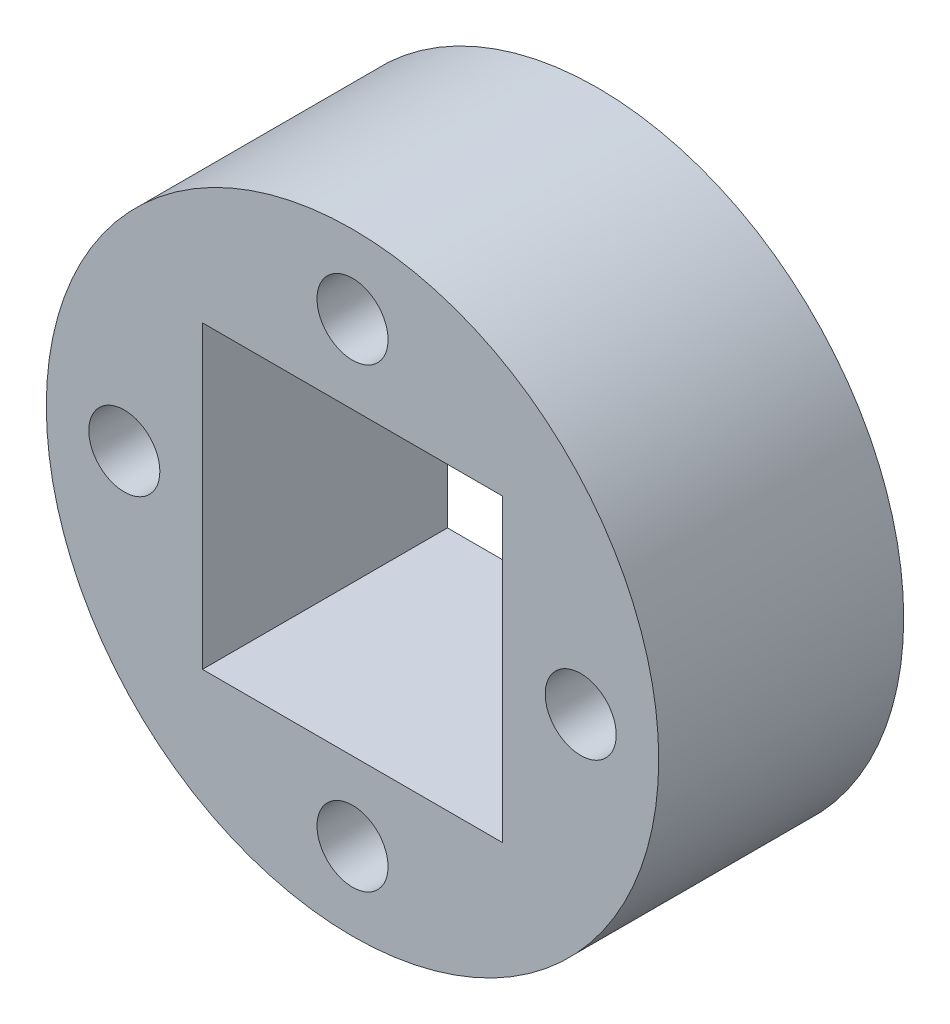
from build123d import *

# Parameters (mm, degrees)
SKETCH1_R           = 12.5
BOSS_EXTRUDE1_DEPTH = 5
CUT_EXTRUDE1_REACH  = 22.31
SKETCH8_W           = 12.25
SKETCH8_H           = 12.25
CUT_EXTRUDE4_REACH  = 22.31
SKETCH11_R          = 1.45


with BuildPart() as part:
    # Sketch1 → Boss-Extrude1 (new, symmetric)
    with BuildSketch(Plane.XY):
        Circle(SKETCH1_R)
    extrude(amount=BOSS_EXTRUDE1_DEPTH, both=True)

    # Sketch8 → Cut-Extrude1 (cut, up to next)
    with BuildSketch(Plane.XY.offset(5), mode=Mode.PRIVATE) as cut_extrude1_sk1:
        Rectangle(SKETCH8_W, SKETCH8_H)
    cut_extrude1_tool1 = extrude(cut_extrude1_sk1.sketch, amount=-CUT_EXTRUDE1_REACH, mode=Mode.PRIVATE) & part.part
    add(cut_extrude1_tool1.solids().sort_by_distance((0, 0, 5))[0], mode=Mode.SUBTRACT)

    # Sketch11 → Cut-Extrude4 (cut, up to next)
    with BuildSketch(Plane.XY.offset(5), mode=Mode.PRIVATE) as cut_extrude4_sk1:
        with Locations((9.315, 0)):
            Circle(SKETCH11_R)
    cut_extrude4_tool1 = extrude(cut_extrude4_sk1.sketch, amount=-CUT_EXTRUDE4_REACH, mode=Mode.PRIVATE) & part.part
    # Sketch11 → Cut-Extrude4 (cut, up to next)
    with BuildSketch(Plane.XY.offset(5), mode=Mode.PRIVATE) as cut_extrude4_sk2:
        with Locations((0, -9.315)):
            Circle(SKETCH11_R)
    cut_extrude4_tool2 = extrude(cut_extrude4_sk2.sketch, amount=-CUT_EXTRUDE4_REACH, mode=Mode.PRIVATE) & part.part
    # Sketch11 → Cut-Extrude4 (cut, up to next)
    with BuildSketch(Plane.XY.offset(5), mode=Mode.PRIVATE) as cut_extrude4_sk3:
        with Locations((-9.315, 0)):
            Circle(SKETCH11_R)
    cut_extrude4_tool3 = extrude(cut_extrude4_sk3.sketch, amount=-CUT_EXTRUDE4_REACH, mode=Mode.PRIVATE) & part.part
    # Sketch11 → Cut-Extrude4 (cut, up to next)
    with BuildSketch(Plane.XY.offset(5), mode=Mode.PRIVATE) as cut_extrude4_sk4:
        with Locations((0, 9.315)):
            Circle(SKETCH11_R)
    cut_extrude4_tool4 = extrude(cut_extrude4_sk4.sketch, amount=-CUT_EXTRUDE4_REACH, mode=Mode.PRIVATE) & part.part
    add(cut_extrude4_tool1.solids().sort_by_distance((9.315, 0, 5))[0], mode=Mode.SUBTRACT)
    add(cut_extrude4_tool2.solids().sort_by_distance((0, -9.315, 5))[0], mode=Mode.SUBTRACT)
    add(cut_extrude4_tool3.solids().sort_by_distance((-9.315, 0, 5))[0], mode=Mode.SUBTRACT)
    add(cut_extrude4_tool4.solids().sort_by_distance((0, 9.315, 5))[0], mode=Mode.SUBTRACT)


solid = part.part
